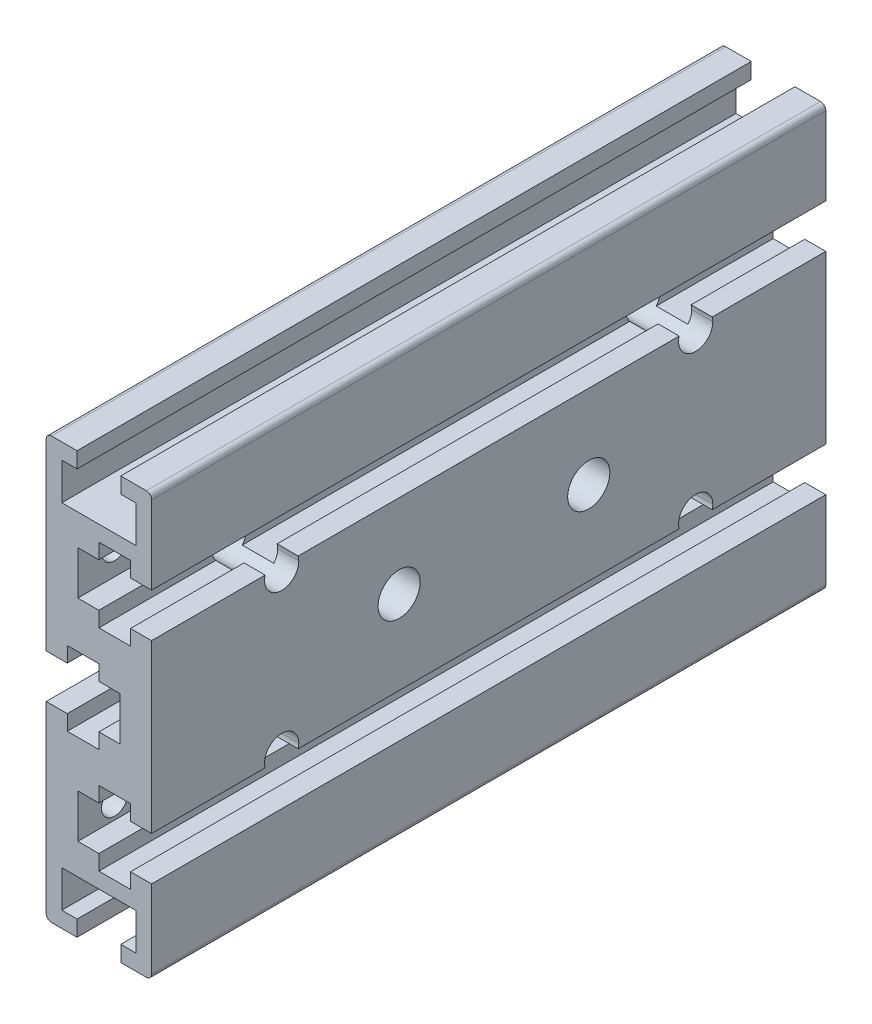
from build123d import *

# Parameters (mm, degrees)
EXTRUDE_1_DEPTH         = 128
HOLE_WIZARD_5_0_5_1_D   = 5
HOLE_WIZARD_6_5_6_5_1_D = 6.5
HOLE_WIZARD_8_0_8_1_D   = 8


with BuildPart() as part:
    # Sketch1 → 凸台-拉伸1 (new body)
    with BuildSketch(Plane.XY):
        with BuildLine():
            Line((-9, 40), (-4.15, 40))
            Line((-4.15, 40), (-4.15, 37))
            Line((-4.15, 37), (-7.05, 37))
            Line((-7.05, 37), (-7.05, 30))
            Line((-7.05, 30), (7.05, 30))
            Line((7.05, 30), (7.05, 37))
            Line((7.05, 37), (4.15, 37))
            Line((4.15, 37), (4.15, 40))
            Line((4.15, 40), (9, 40))
            ThreePointArc((9, 40), (9.707106781, 39.707106781), (10, 39))
            Line((10, 39), (10, 24.15))
            Line((10, 24.15), (6, 24.15))
            Line((6, 24.15), (6, 27.05))
            Line((6, 27.05), (0, 27.05))
            Line((0, 27.05), (0, 24.15))
            Line((0, 24.15), (-4, 24.15))
            Line((-4, 24.15), (-4, 15.85))
            Line((-4, 15.85), (0, 15.85))
            Line((0, 15.85), (0, 12.95))
            Line((0, 12.95), (6, 12.95))
            Line((6, 12.95), (6, 15.85))
            Line((6, 15.85), (10, 15.85))
            Line((10, 15.85), (10, -15.85))
            Line((10, -15.85), (6, -15.85))
            Line((6, -15.85), (6, -12.95))
            Line((6, -12.95), (0, -12.95))
            Line((0, -12.95), (0, -15.85))
            Line((0, -15.85), (-4, -15.85))
            Line((-4, -15.85), (-4, -24.15))
            Line((-4, -24.15), (0, -24.15))
            Line((0, -24.15), (0, -27.05))
            Line((0, -27.05), (6, -27.05))
            Line((6, -27.05), (6, -24.15))
            Line((6, -24.15), (10, -24.15))
            Line((10, -24.15), (10, -39))
            ThreePointArc((10, -39), (9.707106781, -39.707106781), (9, -40))
            Line((9, -40), (4.15, -40))
            Line((4.15, -40), (4.15, -37))
            Line((4.15, -37), (7.05, -37))
            Line((7.05, -37), (7.05, -30))
            Line((7.05, -30), (-7.05, -30))
            Line((-7.05, -30), (-7.05, -37))
            Line((-7.05, -37), (-4.15, -37))
            Line((-4.15, -37), (-4.15, -40))
            Line((-4.15, -40), (-9, -40))
            ThreePointArc((-9, -40), (-9.707106781, -39.707106781), (-10, -39))
            Line((-10, -39), (-10, -4.15))
            Line((-10, -4.15), (-6, -4.15))
            Line((-6, -4.15), (-6, -7.05))
            Line((-6, -7.05), (0, -7.05))
            Line((0, -7.05), (0, -4.15))
            Line((0, -4.15), (4, -4.15))
            Line((4, -4.15), (4, 4.15))
            Line((4, 4.15), (0, 4.15))
            Line((0, 4.15), (0, 7.05))
            Line((0, 7.05), (-6, 7.05))
            Line((-6, 7.05), (-6, 4.15))
            Line((-6, 4.15), (-10, 4.15))
            Line((-10, 4.15), (-10, 39))
            ThreePointArc((-10, 39), (-9.707106781, 39.707106781), (-9, 40))
        make_face()
    extrude(amount=EXTRUDE_1_DEPTH)

    # Ø5.0 (5) 直径孔1 (through all)
    with Locations(Plane(origin=(-4, 0, 0), x_dir=(0, 0, -1), z_dir=(1, 0, 0))):
        with Locations((-121, 21), (-97, 21), (-31, 21), (-7, 21), (-7, -21), (-31, -21), (-97, -21), (-121, -21)):
            Hole(HOLE_WIZARD_5_0_5_1_D / 2)

    # Ø6.5 (6.5) 直径孔1_电机底座 (through all)
    with Locations(Plane(origin=(10, 0, 0), x_dir=(0, 0, -1), z_dir=(1, 0, 0))):
        with Locations((-103.3, 15), (-24.7, 15), (-24.7, -15), (-103.3, -15)):
            Hole(HOLE_WIZARD_6_5_6_5_1_D / 2)

    # Ø8.0 (8) 直径孔1 (through all)
    with Locations(Plane(origin=(10, 0, 0), x_dir=(0, 0, -1), z_dir=(1, 0, 0))):
        with Locations((-81, 0), (-45, 0)):
            Hole(HOLE_WIZARD_8_0_8_1_D / 2)


solid = part.part
